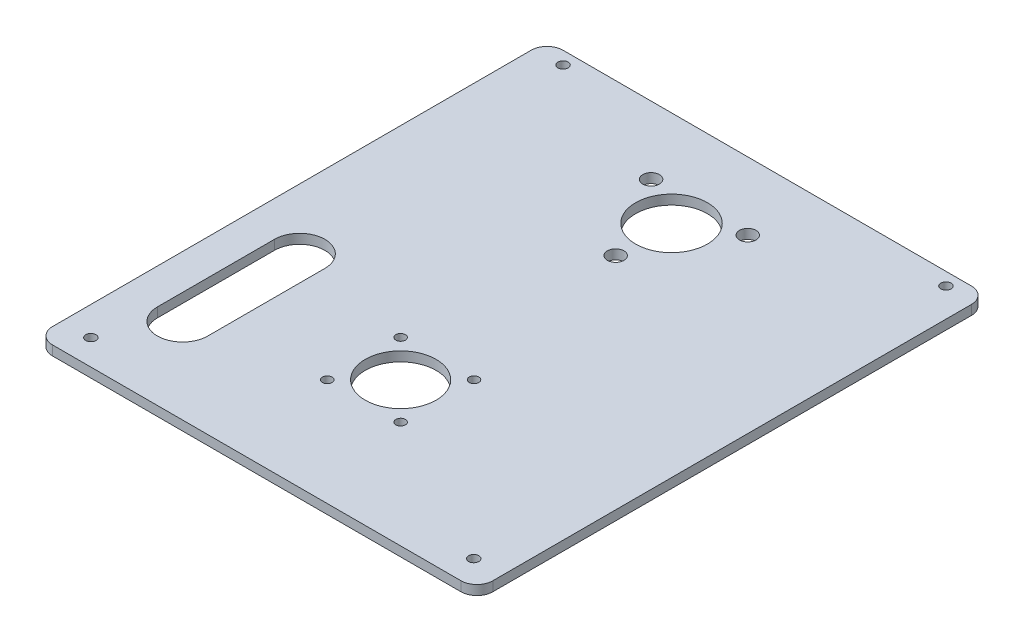
from build123d import *

# Parameters (mm, degrees)
SKETCH_1_R      = 1.6
SKETCH_1_R_2    = 11.1
SKETCH_1_R_3    = 1.5
SKETCH_1_R_4    = 11.25
SKETCH_1_R_5    = 2.6
EXTRUDE_1_DEPTH = 3


with BuildPart() as part:
    # 草图1 → 凸台-拉伸1 (new body)
    with BuildSketch(Plane(origin=(0, 0, 0), x_dir=(1, 0, 0), z_dir=(0, 1, 0))):
        with BuildLine():
            Line((64, -80), (-64, -80))
            ThreePointArc((-64, -80), (-67.535533906, -78.535533906), (-69, -75))
            Line((-69, -75), (-69, 75))
            ThreePointArc((-69, 75), (-67.535533906, 78.535533906), (-64, 80))
            Line((-64, 80), (64, 80))
            ThreePointArc((64, 80), (67.535533906, 78.535533906), (69, 75))
            Line((69, 75), (69, -75))
            ThreePointArc((69, -75), (67.535533906, -78.535533906), (64, -80))
        make_face()
        with Locations(Location((60, 76, 0), (0, 0, 270))):
            Circle(SKETCH_1_R, mode=Mode.SUBTRACT)
        with Locations(Location((-60, 76, 0), (0, 0, 90))):
            Circle(SKETCH_1_R, mode=Mode.SUBTRACT)
        with Locations(Location((0, -34.9, 0), (0, 0, 270))):
            Circle(SKETCH_1_R_2, mode=Mode.SUBTRACT)
        with Locations(Location((11.5, -46.4, 0), (0, 0, 270))):
            Circle(SKETCH_1_R_3, mode=Mode.SUBTRACT)
        with Locations(Location((11.5, -23.4, 0), (0, 0, 270))):
            Circle(SKETCH_1_R_3, mode=Mode.SUBTRACT)
        with Locations(Location((-11.5, -46.4, 0), (0, 0, 90))):
            Circle(SKETCH_1_R_3, mode=Mode.SUBTRACT)
        with Locations(Location((-11.5, -23.4, 0), (0, 0, 90))):
            Circle(SKETCH_1_R_3, mode=Mode.SUBTRACT)
        with Locations(Location((0, 50, 0), (0, 0, 270))):
            Circle(SKETCH_1_R_4, mode=Mode.SUBTRACT)
        with Locations(Location((60, -72, 0), (0, 0, 270))):
            Circle(SKETCH_1_R, mode=Mode.SUBTRACT)
        with Locations(Location((-60, -72, 0), (0, 0, 90))):
            Circle(SKETCH_1_R, mode=Mode.SUBTRACT)
        with Locations(Location((0, 32.5, 0), (0, 0, 270))):
            Circle(SKETCH_1_R_5, mode=Mode.SUBTRACT)
        with Locations(Location((15.15, 58.75, 0), (0, 0, 270))):
            Circle(SKETCH_1_R_5, mode=Mode.SUBTRACT)
        with Locations(Location((-15.15, 58.75, 0), (0, 0, 90))):
            Circle(SKETCH_1_R_5, mode=Mode.SUBTRACT)
        with BuildLine():
            Line((-42.1, -16.55), (-42.1, -53.25))
            ThreePointArc((-42.1, -53.25), (-50, -61.15), (-57.9, -53.25))
            Line((-57.9, -53.25), (-57.9, -16.55))
            ThreePointArc((-57.9, -16.55), (-50, -8.65), (-42.1, -16.55))
        make_face(mode=Mode.SUBTRACT)
    extrude(amount=EXTRUDE_1_DEPTH)


solid = part.part
